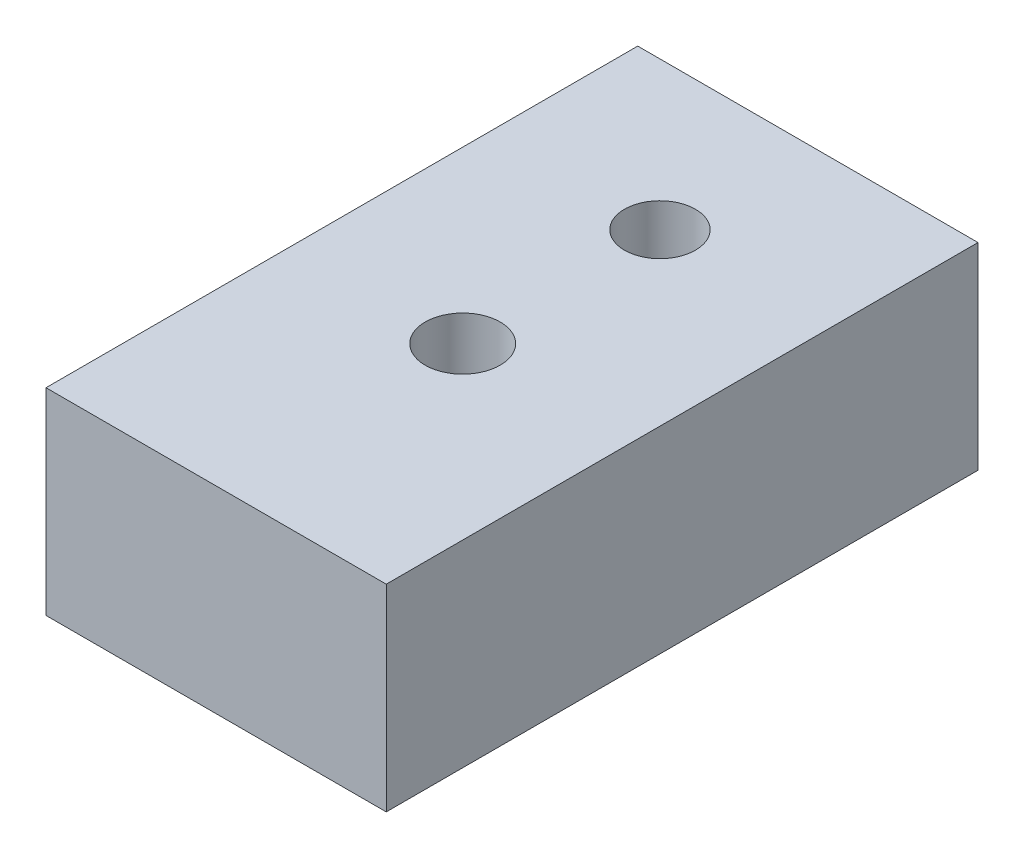
from build123d import *

# Parameters (mm, degrees)
SKETCH1_W           = 21.9075
SKETCH1_H           = 38.1
BOSS_EXTRUDE1_DEPTH = 12.7
SKETCH2_R           = 2.286
SKETCH2_R_2         = 2.413
CUT_EXTRUDE1_DEPTH  = 26.380644969


with BuildPart() as part:
    # Sketch1 → Boss-Extrude1 (new body)
    with BuildSketch(Plane(origin=(0, 0, 0), x_dir=(1, 0, 0), z_dir=(0, 1, 0))):
        Rectangle(SKETCH1_W, SKETCH1_H)
    extrude(amount=BOSS_EXTRUDE1_DEPTH)

    # Sketch2 → Cut-Extrude1 (cut, through all)
    with BuildSketch(Plane(origin=(0, 12.7, 0), x_dir=(1, 0, 0), z_dir=(0, 1, 0))):
        with Locations(Location((0, 9.525, 0), (0, 0, 270))):
            Circle(SKETCH2_R)
        with Locations(Location((0, -3.175, 0), (0, 0, 270))):
            Circle(SKETCH2_R_2)
    extrude(amount=-CUT_EXTRUDE1_DEPTH, mode=Mode.SUBTRACT)


solid = part.part
